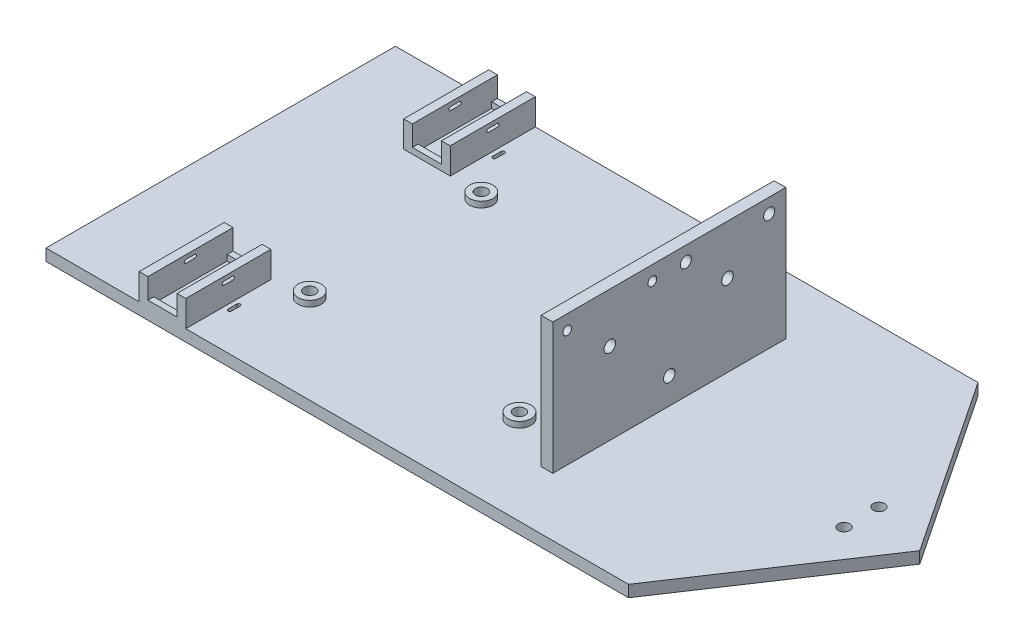
from build123d import *

# Parameters (mm, degrees)
BOSS_EXTRUDE1_DEPTH = 5.08
SKETCH2_R           = 2.54
CUT_EXTRUDE1_DEPTH  = 341.814621752
SKETCH3_R           = 2.54
CUT_EXTRUDE2_DEPTH  = 341.814621752
SKETCH4_W           = 3.81
SKETCH4_H           = 37.084
BOSS_EXTRUDE2_DEPTH = 11.43
SKETCH5_W           = 12.7
SKETCH5_H           = 2.54
BOSS_EXTRUDE3_DEPTH = 2.54
BOSS_EXTRUDE4_START = 2.54
SKETCH6_R           = 5.08
SKETCH6_R_2         = 2.54
BOSS_EXTRUDE4_DEPTH = 2.54
SKETCH7_W           = 5.08
SKETCH7_H           = 101.6
BOSS_EXTRUDE5_DEPTH = 57.15
CUT_EXTRUDE3_REACH  = 257.636
SKETCH8_R           = 1.905
SKETCH8_R_2         = 2.54
CUT_EXTRUDE5_REACH  = 257.636
SKETCH10_R          = 2.54
CUT_EXTRUDE7_DEPTH  = 25.4
CUT_EXTRUDE8_DEPTH  = 25.4
CUT_EXTRUDE9_DEPTH  = 346.535703654
SKETCH15_R          = 2.413
SKETCH15_R_2        = 2.54
CUT_EXTRUDE10_DEPTH = 256.636204987


with BuildPart() as part:
    # Sketch1 → Boss-Extrude1 (new body)
    with BuildSketch(Plane(origin=(0, 0, 0), x_dir=(1, 0, 0), z_dir=(0, 1, 0))):
        Polygon((0, 0), (254, 0), (304.8, 76.2), (254, 152.4), (0, 152.4), align=None)
    extrude(amount=BOSS_EXTRUDE1_DEPTH)

    # Sketch2 → Cut-Extrude1 (cut, through all)
    with BuildSketch(Plane(origin=(0, 5.08, 0), x_dir=(1, 0, 0), z_dir=(0, 1, 0))):
        with Locations(Location((76.2, 38.7985, 0), (0, 0, 270))):
            Circle(SKETCH2_R)
        with Locations(Location((167.64, 38.7985, 0), (0, 0, 270))):
            Circle(SKETCH2_R)
        with Locations(Location((167.64, 113.6015, 0), (0, 0, 90))):
            Circle(SKETCH2_R)
        with Locations(Location((76.2, 113.6015, 0), (0, 0, 90))):
            Circle(SKETCH2_R)
    extrude(amount=-CUT_EXTRUDE1_DEPTH, mode=Mode.SUBTRACT)

    # Sketch3 → Cut-Extrude2 (cut, through all)
    with BuildSketch(Plane(origin=(0, 5.08, 0), x_dir=(1, 0, 0), z_dir=(0, 1, 0))):
        with Locations(Location((279.4, 68.58, 0), (0, 0, 270))):
            Circle(SKETCH3_R)
        with Locations(Location((279.4, 83.82, 0), (0, 0, 90))):
            Circle(SKETCH3_R)
    extrude(amount=-CUT_EXTRUDE2_DEPTH, mode=Mode.SUBTRACT)

    # Sketch4 → Boss-Extrude2 (add)
    with BuildSketch(Plane(origin=(0, 5.08, 0), x_dir=(1, 0, 0), z_dir=(0, 1, 0))):
        with Locations((42.545, 18.542)):
            Rectangle(SKETCH4_W, SKETCH4_H)
        with Locations((59.055, 18.542)):
            Rectangle(SKETCH4_W, SKETCH4_H)
        with Locations((59.055, 133.858)):
            Rectangle(SKETCH4_W, SKETCH4_H)
        with Locations((42.545, 133.858)):
            Rectangle(SKETCH4_W, SKETCH4_H)
    extrude(amount=BOSS_EXTRUDE2_DEPTH)

    # Sketch5 → Boss-Extrude3 (add)
    with BuildSketch(Plane(origin=(0, 5.08, 0), x_dir=(1, 0, 0), z_dir=(0, 1, 0))):
        with Locations((50.8, 1.27)):
            Rectangle(SKETCH5_W, SKETCH5_H)
        with Locations((50.8, 151.13)):
            Rectangle(SKETCH5_W, SKETCH5_H)
        with Locations((50.8, 116.586)):
            Rectangle(SKETCH5_W, SKETCH5_H)
        with Locations((50.8, 35.814)):
            Rectangle(SKETCH5_W, SKETCH5_H)
    extrude(amount=BOSS_EXTRUDE3_DEPTH)

    # Sketch6 → Boss-Extrude4 (add)
    # profile 1 of 4: a face of its own
    with BuildSketch(Plane(origin=(0, 5.08, 0), x_dir=(1, 0, 0), z_dir=(0, 1, 0)).offset(BOSS_EXTRUDE4_START)):
        with Locations(Location((76.2, 38.7985, 0), (0, 0, 90))):
            Circle(SKETCH6_R)
        with Locations(Location((76.2, 38.7985, 0), (0, 0, 270))):
            Circle(SKETCH6_R_2, mode=Mode.SUBTRACT)
    # profile 2 of 4: a face of its own
    with BuildSketch(Plane(origin=(0, 5.08, 0), x_dir=(1, 0, 0), z_dir=(0, 1, 0)).offset(BOSS_EXTRUDE4_START)):
        with Locations(Location((167.64, 38.7985, 0), (0, 0, 90))):
            Circle(SKETCH6_R)
        with Locations(Location((167.64, 38.7985, 0), (0, 0, 270))):
            Circle(SKETCH6_R_2, mode=Mode.SUBTRACT)
    # profile 3 of 4: a face of its own
    with BuildSketch(Plane(origin=(0, 5.08, 0), x_dir=(1, 0, 0), z_dir=(0, 1, 0)).offset(BOSS_EXTRUDE4_START)):
        with Locations(Location((167.64, 113.6015, 0), (0, 0, 90))):
            Circle(SKETCH6_R)
        with Locations(Location((167.64, 113.6015, 0), (0, 0, 270))):
            Circle(SKETCH6_R_2, mode=Mode.SUBTRACT)
    # profile 4 of 4: a face of its own
    with BuildSketch(Plane(origin=(0, 5.08, 0), x_dir=(1, 0, 0), z_dir=(0, 1, 0)).offset(BOSS_EXTRUDE4_START)):
        with Locations(Location((76.2, 113.6015, 0), (0, 0, 90))):
            Circle(SKETCH6_R)
        with Locations(Location((76.2, 113.6015, 0), (0, 0, 90))):
            Circle(SKETCH6_R_2, mode=Mode.SUBTRACT)
    extrude(amount=-BOSS_EXTRUDE4_DEPTH)

    # Sketch7 → Boss-Extrude5 (add)
    with BuildSketch(Plane(origin=(0, 5.08, 0), x_dir=(1, 0, 0), z_dir=(0, 1, 0))):
        with Locations((193.04, 76.2)):
            Rectangle(SKETCH7_W, SKETCH7_H)
    extrude(amount=BOSS_EXTRUDE5_DEPTH)

    # Sketch8 → Cut-Extrude3 (cut, up to next)
    with BuildSketch(Plane(origin=(195.58, 0, 0), x_dir=(0, 0, -1), z_dir=(1, 0, 0)), mode=Mode.PRIVATE) as cut_extrude3_sk1:
        with Locations((31.75, 55.88)):
            Circle(SKETCH8_R)
    cut_extrude3_tool1 = extrude(cut_extrude3_sk1.sketch, amount=-CUT_EXTRUDE3_REACH, mode=Mode.PRIVATE) & part.part
    # Sketch8 → Cut-Extrude3 (cut, up to next)
    with BuildSketch(Plane(origin=(195.58, 0, 0), x_dir=(0, 0, -1), z_dir=(1, 0, 0)), mode=Mode.PRIVATE) as cut_extrude3_sk2:
        with Locations((68.834, 55.88)):
            Circle(SKETCH8_R)
    cut_extrude3_tool2 = extrude(cut_extrude3_sk2.sketch, amount=-CUT_EXTRUDE3_REACH, mode=Mode.PRIVATE) & part.part
    # Sketch8 → Cut-Extrude3 (cut, up to next)
    with BuildSketch(Plane(origin=(195.58, 0, 0), x_dir=(0, 0, -1), z_dir=(1, 0, 0)), mode=Mode.PRIVATE) as cut_extrude3_sk3:
        with Locations((50.292, 40.64)):
            Circle(SKETCH8_R_2)
    cut_extrude3_tool3 = extrude(cut_extrude3_sk3.sketch, amount=-CUT_EXTRUDE3_REACH, mode=Mode.PRIVATE) & part.part
    add(cut_extrude3_tool1.solids().sort_by_distance((195.58, 55.88, -31.75))[0], mode=Mode.SUBTRACT)
    add(cut_extrude3_tool2.solids().sort_by_distance((195.58, 55.88, -68.834))[0], mode=Mode.SUBTRACT)
    add(cut_extrude3_tool3.solids().sort_by_distance((195.58, 40.64, -50.292))[0], mode=Mode.SUBTRACT)

    # Sketch10 → Cut-Extrude5 (cut, up to next)
    with BuildSketch(Plane(origin=(195.58, 0, 0), x_dir=(0, 0, -1), z_dir=(1, 0, 0)), mode=Mode.PRIVATE) as cut_extrude5_sk1:
        with Locations((76.2, 16.51)):
            Circle(SKETCH10_R)
    cut_extrude5_tool1 = extrude(cut_extrude5_sk1.sketch, amount=-CUT_EXTRUDE5_REACH, mode=Mode.PRIVATE) & part.part
    add(cut_extrude5_tool1.solids().sort_by_distance((195.58, 16.51, -76.2))[0], mode=Mode.SUBTRACT)

    # Sketch12 → Cut-Extrude7 (cut)
    with BuildSketch(Plane.ZY.offset(-40.64)):
        with BuildLine():
            Line((-20.447, 14.732), (-16.637, 14.732))
            ThreePointArc((-16.637, 14.732), (-15.875, 13.97), (-16.637, 13.208))
            Line((-16.637, 13.208), (-20.447, 13.208))
            ThreePointArc((-20.447, 13.208), (-21.209, 13.97), (-20.447, 14.732))
        make_face()
    extrude(amount=-CUT_EXTRUDE7_DEPTH, mode=Mode.SUBTRACT)

    # Sketch13 → Cut-Extrude8 (cut)
    with BuildSketch(Plane.ZY.offset(-40.64)):
        with BuildLine():
            Line((-135.763, 14.732), (-131.953, 14.732))
            ThreePointArc((-131.953, 14.732), (-131.191, 13.97), (-131.953, 13.208))
            Line((-131.953, 13.208), (-135.763, 13.208))
            ThreePointArc((-135.763, 13.208), (-136.525, 13.97), (-135.763, 14.732))
        make_face()
    extrude(amount=-CUT_EXTRUDE8_DEPTH, mode=Mode.SUBTRACT)

    # Sketch14 → Cut-Extrude9 (cut, through all)
    with BuildSketch(Plane(origin=(0, 5.08, 0), x_dir=(1, 0, 0), z_dir=(0, 1, 0))):
        with BuildLine():
            Line((37.338, 16.637), (37.338, 20.447))
            ThreePointArc((37.338, 20.447), (38.1, 21.209), (38.862, 20.447))
            Line((38.862, 20.447), (38.862, 16.637))
            ThreePointArc((38.862, 16.637), (38.1, 15.875), (37.338, 16.637))
        make_face()
        with BuildLine():
            Line((64.262, 16.637), (64.262, 20.447))
            ThreePointArc((64.262, 20.447), (63.5, 21.209), (62.738, 20.447))
            Line((62.738, 20.447), (62.738, 16.637))
            ThreePointArc((62.738, 16.637), (63.5, 15.875), (64.262, 16.637))
        make_face()
        with BuildLine():
            Line((37.338, 135.763), (37.338, 131.953))
            ThreePointArc((37.338, 131.953), (38.1, 131.191), (38.862, 131.953))
            Line((38.862, 131.953), (38.862, 135.763))
            ThreePointArc((38.862, 135.763), (38.1, 136.525), (37.338, 135.763))
        make_face()
        with BuildLine():
            Line((64.262, 135.763), (64.262, 131.953))
            ThreePointArc((64.262, 131.953), (63.5, 131.191), (62.738, 131.953))
            Line((62.738, 131.953), (62.738, 135.763))
            ThreePointArc((62.738, 135.763), (63.5, 136.525), (64.262, 135.763))
        make_face()
    extrude(amount=-CUT_EXTRUDE9_DEPTH, mode=Mode.SUBTRACT)

    # Sketch15 → Cut-Extrude10 (cut, through all)
    with BuildSketch(Plane(origin=(195.58, 0, 0), x_dir=(0, 0, -1), z_dir=(1, 0, 0))):
        with Locations((83.4136, 55.88)):
            Circle(SKETCH15_R)
        with Locations((119.7864, 55.88)):
            Circle(SKETCH15_R)
        with Locations((101.6, 40.64)):
            Circle(SKETCH15_R_2)
    extrude(amount=-CUT_EXTRUDE10_DEPTH, mode=Mode.SUBTRACT)


solid = part.part
